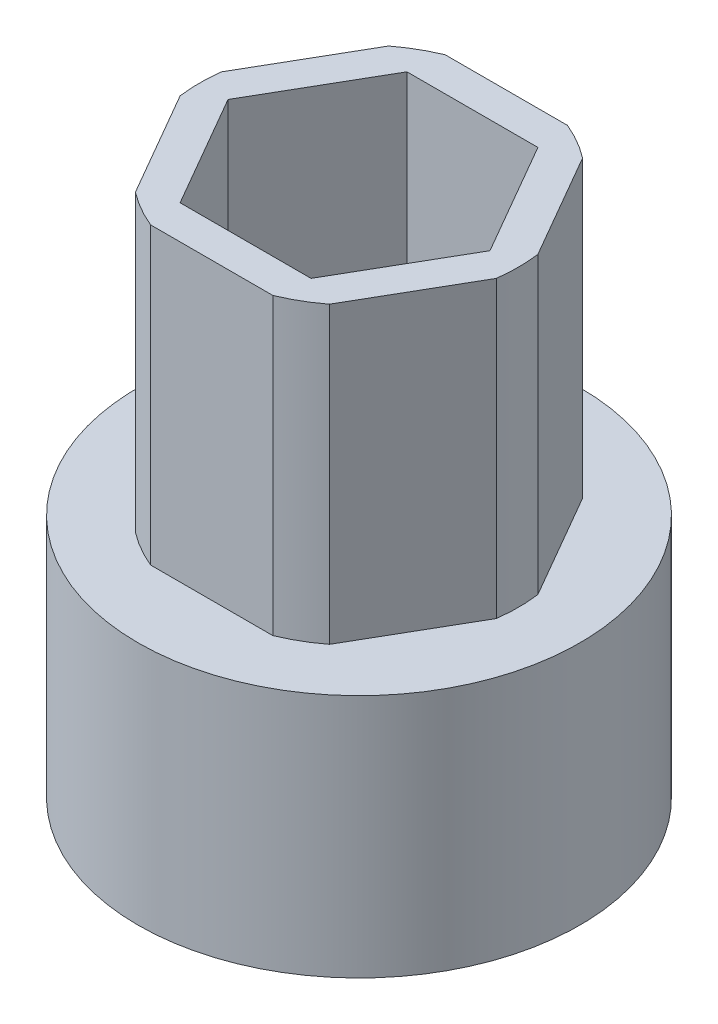
from build123d import *

# Parameters (mm, degrees)
SKETCH1_R           = 9.525
BOSS_EXTRUDE1_DEPTH = 10.541
BOSS_EXTRUDE2_DEPTH = 12.7


with BuildPart() as part:
    # Sketch1 → Boss-Extrude1 (new body)
    with BuildSketch(Plane(origin=(0, 0, 0), x_dir=(1, 0, 0), z_dir=(0, 1, 0))):
        with Locations(Location((0, 0, 0), (0, 0, 270))):
            Circle(SKETCH1_R)
        Polygon((5.645908282, 0), (2.822954141, 4.8895), (-2.822954141, 4.8895), (-5.645908282, 0), (-2.822954141, -4.8895), (2.822954141, -4.8895), align=None, mode=Mode.SUBTRACT)
    extrude(amount=BOSS_EXTRUDE1_DEPTH)

    # Sketch2 → Boss-Extrude2 (add)
    with BuildSketch(Plane(origin=(0, 10.541, 0), x_dir=(1, 0, 0), z_dir=(0, 1, 0))):
        with BuildLine():
            Line((4.181770802, -5.456960506), (6.816751826, -0.893039494))
            ThreePointArc((6.816751826, -0.893039494), (6.875, 0), (6.816751826, 0.893039494))
            Line((6.816751826, 0.893039494), (4.181770802, 5.456960506))
            ThreePointArc((4.181770802, 5.456960506), (3.4375, 5.953924651), (2.634981025, 6.35))
            Line((2.634981025, 6.35), (-2.634981025, 6.35))
            ThreePointArc((-2.634981025, 6.35), (-3.4375, 5.953924651), (-4.181770802, 5.456960506))
            Line((-4.181770802, 5.456960506), (-6.816751826, 0.893039494))
            ThreePointArc((-6.816751826, 0.893039494), (-6.875, 0), (-6.816751826, -0.893039494))
            Line((-6.816751826, -0.893039494), (-4.181770802, -5.456960506))
            ThreePointArc((-4.181770802, -5.456960506), (-3.4375, -5.953924651), (-2.634981025, -6.35))
            Line((-2.634981025, -6.35), (2.634981025, -6.35))
            ThreePointArc((2.634981025, -6.35), (3.4375, -5.953924651), (4.181770802, -5.456960506))
        make_face()
        Polygon((-2.822954141, 4.8895), (2.822954141, 4.8895), (5.645908282, 0), (2.822954141, -4.8895), (-2.822954141, -4.8895), (-5.645908282, 0), align=None, mode=Mode.SUBTRACT)
    extrude(amount=BOSS_EXTRUDE2_DEPTH)


solid = part.part
